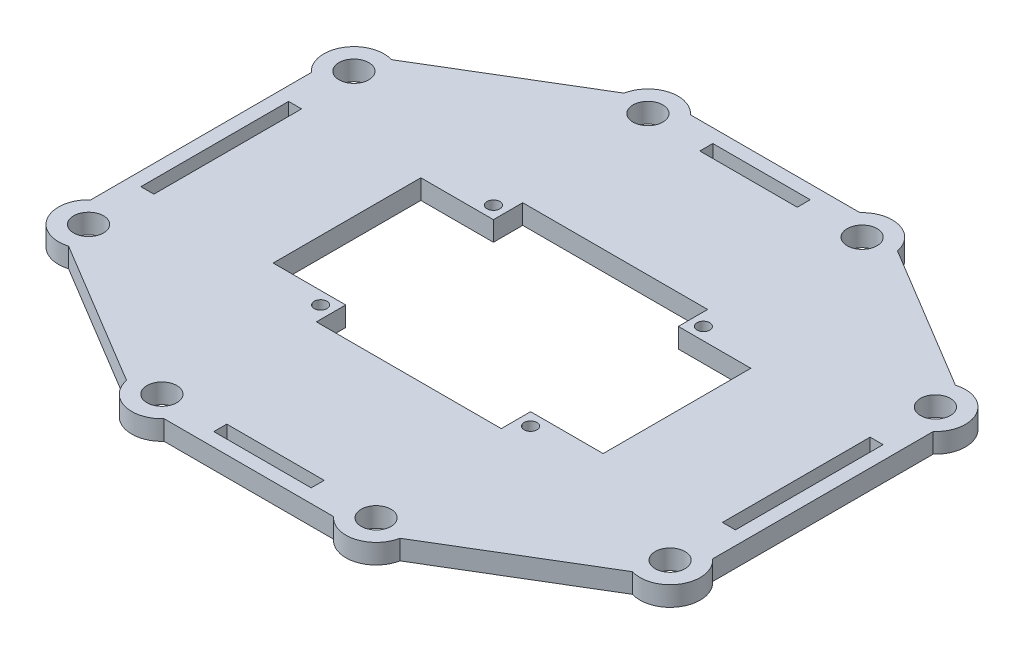
from build123d import *

# Parameters (mm, degrees)
SKETCH1_W           = 23.622
SKETCH1_H           = 3.1496
SKETCH1_R           = 1.55575
SKETCH1_W_2         = 3.1496
SKETCH1_H_2         = 35.814
BOSS_EXTRUDE2_DEPTH = 4.7625
SKETCH1_4_R         = 3.6195
CUT_EXTRUDE1_DEPTH  = 4.7625


with BuildPart() as part:
    # Sketch1 → Boss-Extrude2 (new body)
    with BuildSketch(Plane(origin=(0, 0, 0), x_dir=(1, 0, 0), z_dir=(0, 1, 0))):
        with BuildLine():
            ThreePointArc((-68.367301266, 39.147584106), (-76.853616644, 35.758418209), (-75.3872, 26.738794248))
            Line((-75.3872, 26.738794248), (-75.3872, -26.738794248))
            ThreePointArc((-75.3872, -26.738794248), (-76.853616644, -35.758418209), (-68.367301266, -39.147584106))
            Line((-68.367301266, -39.147584106), (-33.139128227, -60.318651017))
            ThreePointArc((-33.139128227, -60.318651017), (-27.923290386, -65.958483133), (-20.547544248, -63.81115))
            Line((-20.547544248, -63.81115), (20.547544248, -63.81115))
            ThreePointArc((20.547544248, -63.81115), (27.923290386, -65.958483133), (33.139128227, -60.318651017))
            Line((33.139128227, -60.318651017), (68.367301266, -39.147584106))
            ThreePointArc((68.367301266, -39.147584106), (76.853616644, -35.758418209), (75.3872, -26.738794248))
            Line((75.3872, -26.738794248), (75.3872, 26.738794248))
            ThreePointArc((75.3872, 26.738794248), (76.853616644, 35.758418209), (68.367301266, 39.147584106))
            Line((68.367301266, 39.147584106), (33.139128227, 60.318651017))
            ThreePointArc((33.139128227, 60.318651017), (27.923290386, 65.958483133), (20.547544248, 63.81115))
            Line((20.547544248, 63.81115), (-20.547544248, 63.81115))
            ThreePointArc((-20.547544248, 63.81115), (-27.923290386, 65.958483133), (-33.139128227, 60.318651017))
            Line((-33.139128227, 60.318651017), (-68.367301266, 39.147584106))
        make_face()
        with Locations((0, 58.92165)):
            Rectangle(SKETCH1_W, SKETCH1_H, mode=Mode.SUBTRACT)
        with Locations((-25.45715, -20.94865)):
            Circle(SKETCH1_R, mode=Mode.SUBTRACT)
        with Locations((0, -58.92165)):
            Rectangle(SKETCH1_W, SKETCH1_H, mode=Mode.SUBTRACT)
        with Locations((25.45715, -20.94865)):
            Circle(SKETCH1_R, mode=Mode.SUBTRACT)
        with Locations((-70.4977, 0)):
            Rectangle(SKETCH1_W_2, SKETCH1_H_2, mode=Mode.SUBTRACT)
        with Locations((-25.45715, 20.94865)):
            Circle(SKETCH1_R, mode=Mode.SUBTRACT)
        Polygon((-40.005, -17.907), (-40.005, 17.907), (-22.4155, 17.907), (-22.4155, 25.019), (22.4155, 25.019), (22.4155, 17.907), (40.005, 17.907), (40.005, -17.907), (22.4155, -17.907), (22.4155, -25.019), (-22.4155, -25.019), (-22.4155, -17.907), align=None, mode=Mode.SUBTRACT)
        with Locations((25.45715, 20.94865)):
            Circle(SKETCH1_R, mode=Mode.SUBTRACT)
        with Locations((70.4977, 0)):
            Rectangle(SKETCH1_W_2, SKETCH1_H_2, mode=Mode.SUBTRACT)
    extrude(amount=BOSS_EXTRUDE2_DEPTH)

    # Sketch1<4> → Cut-Extrude1 (cut, symmetric)
    with BuildSketch(Plane(origin=(0, 0, 0), x_dir=(1, 0, 0), z_dir=(0, 1, 0))):
        with Locations((25.9715, -58.92165)):
            Circle(SKETCH1_4_R)
        with Locations((-70.4977, 32.16275)):
            Circle(SKETCH1_4_R)
        with Locations((-70.4977, -32.16275)):
            Circle(SKETCH1_4_R)
        with Locations((70.4977, 32.16275)):
            Circle(SKETCH1_4_R)
        with Locations((70.4977, -32.16275)):
            Circle(SKETCH1_4_R)
        with Locations((25.9715, 58.92165)):
            Circle(SKETCH1_4_R)
        with Locations((-25.9715, 58.92165)):
            Circle(SKETCH1_4_R)
        with Locations((-25.9715, -58.92165)):
            Circle(SKETCH1_4_R)
    extrude(amount=CUT_EXTRUDE1_DEPTH, both=True, mode=Mode.SUBTRACT)


solid = part.part
